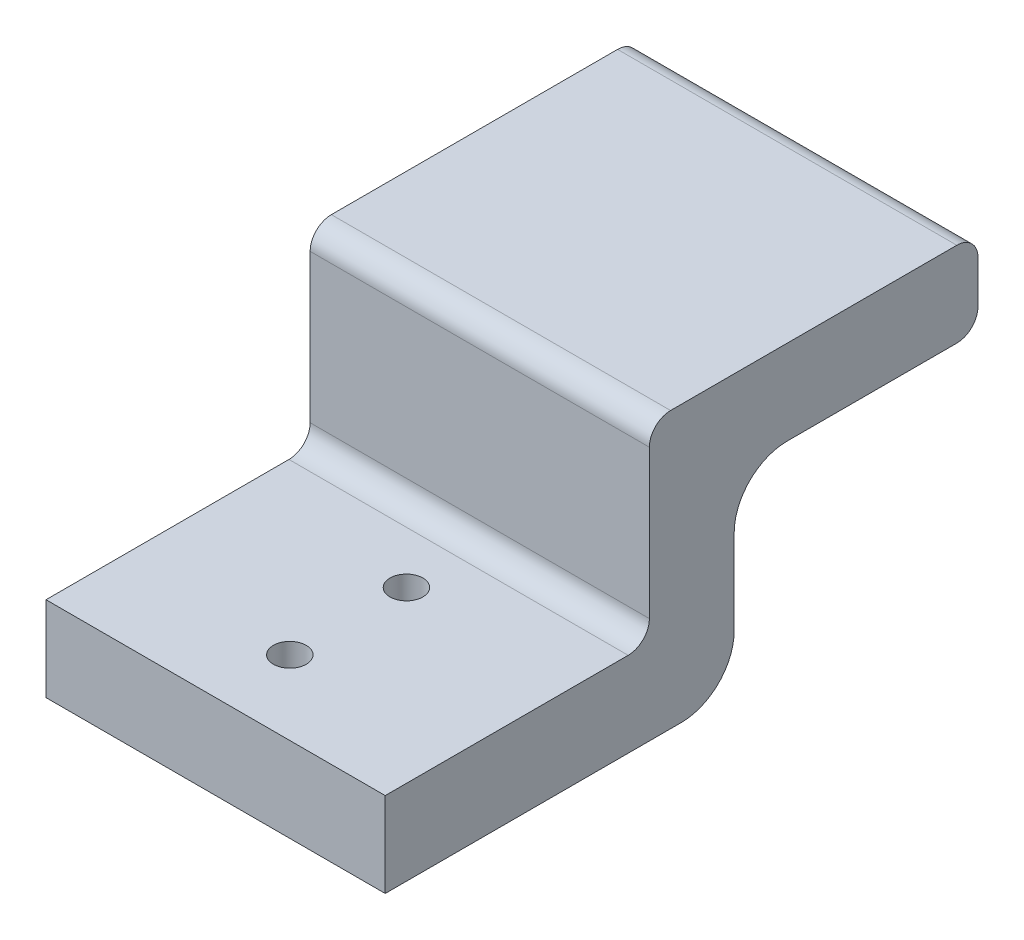
from build123d import *

# Parameters (mm, degrees)
SKETCH_1_W              = 32
SKETCH_1_H              = 32.917571433
EXTRUDE_1_DEPTH         = 8
CUT_EXTRUDE_1_DEPTH     = 2.8
CUT_EXTRUDE_2_DEPTH     = 2.8
HOLE_WIZARD_3_1_3_1_1_D = 3.1
SKETCH_9_W              = 8
SKETCH_9_H              = 18
EXTRUDE_3_DEPTH         = 32
SKETCH_10_W             = 23
SKETCH_10_H             = 8
EXTRUDE_4_DEPTH         = 32
FILLET_1_R              = 2
FILLET_2_R              = 2
FILLET_3_R              = 5


with BuildPart() as part:
    # 草图1 → 凸台-拉伸1 (new body)
    with BuildSketch(Plane.XZ):
        with Locations((0, 6.041214283)):
            Rectangle(SKETCH_1_W, SKETCH_1_H)
    extrude(amount=-EXTRUDE_1_DEPTH)

    # 草图2 → 切除-拉伸1 (cut)
    with BuildSketch(Plane.XZ):
        Polygon((-1.674315781, 18.4), (-3.348631561, 15.5), (-1.674315781, 12.6), (1.674315781, 12.6), (3.348631561, 15.5), (1.674315781, 18.4), align=None)
    extrude(amount=-CUT_EXTRUDE_1_DEPTH, mode=Mode.SUBTRACT)

    # 草图3 → 切除-拉伸2 (cut)
    with BuildSketch(Plane.XZ):
        Polygon((1.674315781, 7.4), (-1.674315781, 7.4), (-3.348631561, 4.5), (-1.674315781, 1.6), (1.674315781, 1.6), (3.348631561, 4.5), align=None)
    extrude(amount=-CUT_EXTRUDE_2_DEPTH, mode=Mode.SUBTRACT)

    # Ø3.1 (3.1) 直径孔1 (through all)
    with Locations(Plane(origin=(0, 2.8, 0), x_dir=(-1, 0, 0), z_dir=(0, -1, 0))):
        with Locations((0, -4.5), (0, -15.5)):
            Hole(HOLE_WIZARD_3_1_3_1_1_D / 2)

    # 草图9 → 凸台-拉伸3 (add)
    with BuildSketch(Plane(origin=(16, 0, 0), x_dir=(0, 0, -1), z_dir=(1, 0, 0))):
        with Locations((6.417571433, 17)):
            Rectangle(SKETCH_9_W, SKETCH_9_H)
    extrude(amount=-EXTRUDE_3_DEPTH)

    # 草图10 → 凸台-拉伸4 (add)
    with BuildSketch(Plane(origin=(16, 0, 0), x_dir=(0, 0, -1), z_dir=(1, 0, 0))):
        with Locations((21.917571433, 22)):
            Rectangle(SKETCH_10_W, SKETCH_10_H)
    extrude(amount=-EXTRUDE_4_DEPTH)

    # 圆角1
    fillet_1_edges = [part.edges().sort_by_distance(p)[0] for p in [
        (0, 8, -2.417571433),
        (0, 26, -2.417571433),
    ]]
    fillet(fillet_1_edges, radius=FILLET_1_R)

    # 圆角2
    fillet_2_edges = [part.edges().sort_by_distance(p)[0] for p in [
        (0, 26, -33.417571433),
        (0, 18, -33.417571433),
    ]]
    fillet(fillet_2_edges, radius=FILLET_2_R)

    # 圆角3
    fillet_3_edges = [part.edges().sort_by_distance(p)[0] for p in [
        (0, 0, -10.417571433),
        (0, 18, -10.417571433),
    ]]
    fillet(fillet_3_edges, radius=FILLET_3_R)


solid = part.part
